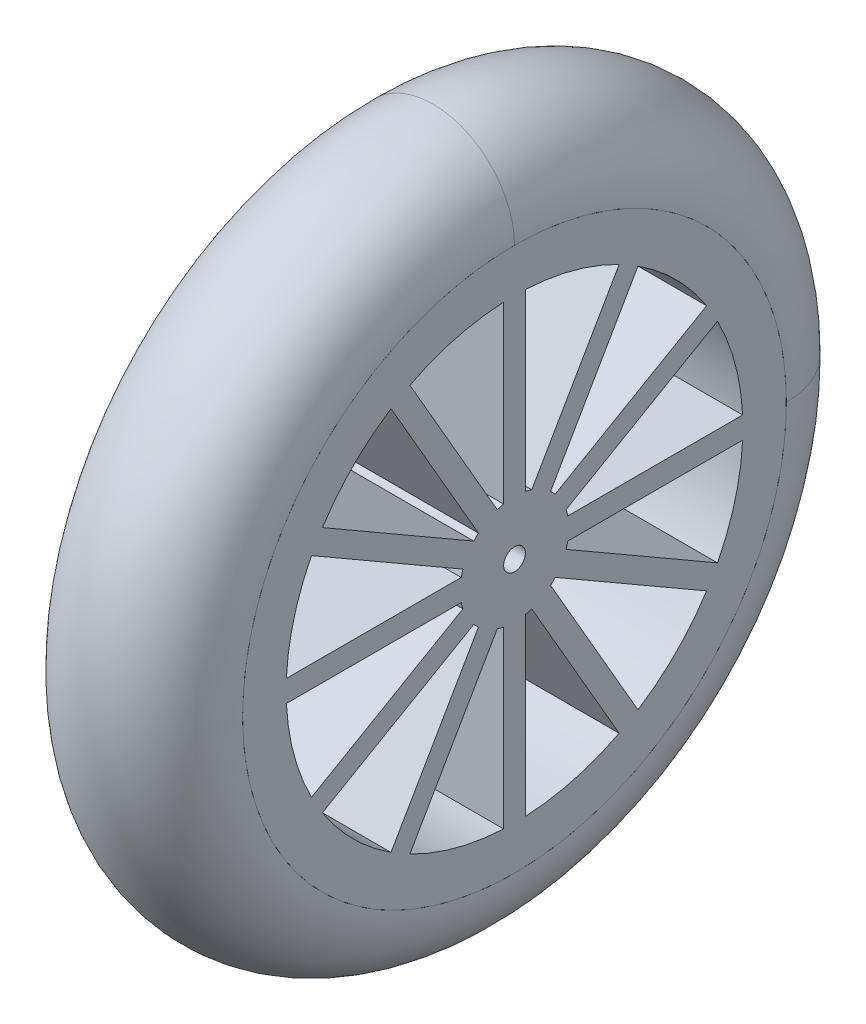
from build123d import *

# Parameters (mm, degrees)
SKETCH1_R               = 31.75
SKETCH1_R_2             = 1.27
BOSS_EXTRUDE1_DEPTH     = 19.05
CUT_EXTRUDE1_DEPTH      = 49.77527549896566
CUT_EXTRUDE1_DEPTH_BACK = 49.77527549896566


with BuildPart() as part:
    # Sketch1 → Boss-Extrude1 (new body)
    with BuildSketch(Plane(origin=(0, 0, 0), x_dir=(0, 0, -1), z_dir=(1, 0, 0))):
        with Locations(Location((0, 0, 0), (0, 0, 180))):
            Circle(SKETCH1_R)
        with Locations(Location((0, 0, 0), (0, 0, 180))):
            Circle(SKETCH1_R_2, mode=Mode.SUBTRACT)
    extrude(amount=BOSS_EXTRUDE1_DEPTH)

    # Sketch2 → Cut-Extrude1 (cut, two sides: drawn at the far end of the back side and taken through both)
    with BuildSketch(Plane(origin=(19.05, 0, 0), x_dir=(0, 0, -1), z_dir=(1, 0, 0)).offset(-CUT_EXTRUDE1_DEPTH_BACK)):
        with BuildLine():
            Line((-1.270000000000003, 6.221703946669272), (-1.27, 26.63974474352185))
            ThreePointArc((-1.27, 26.63974474352185), (-6.902703932884231, 25.76124178712945), (-12.2200201089547, 23.70569569822288))
            Line((-12.2200201089547, 23.70569569822288), (-2.0109997105283997, 6.023153672641492))
            ThreePointArc((-2.0109997105283997, 6.023153672641492), (-1.6435009364010087, 6.133628996935583), (-1.270000000000003, 6.221703946669272))
        make_face()
        with BuildLine():
            Line((1.27, 26.63974474352185), (1.270000000000003, 6.221703946669272))
            ThreePointArc((1.270000000000003, 6.221703946669272), (1.643500936401007, 6.133628996935585), (2.010999710528396, 6.023153672641493))
            Line((2.010999710528396, 6.023153672641493), (12.220020108954685, 23.70569569822289))
            ThreePointArc((12.220020108954685, 23.70569569822289), (6.902703932884228, 25.761241787129453), (1.27, 26.63974474352185))
        make_face()
        with BuildLine():
            Line((14.41972463456716, 22.435695698222887), (4.2107042361408755, 4.753153672641491))
            ThreePointArc((4.2107042361408755, 4.753153672641491), (4.490128060534575, 4.490128060534578), (4.753153672641489, 4.210704236140876))
            Line((4.753153672641489, 4.210704236140876), (22.435695698222883, 14.419724634567164))
            ThreePointArc((22.435695698222883, 14.419724634567164), (18.858537854245217, 18.858537854245224), (14.41972463456716, 22.435695698222887))
        make_face()
        with BuildLine():
            Line((23.705695698222886, 12.22002010895469), (6.023153672641493, 2.0109997105283974))
            ThreePointArc((6.023153672641493, 2.0109997105283974), (6.133628996935583, 1.6435009364010076), (6.221703946669272, 1.2700000000000038))
            Line((6.221703946669272, 1.2700000000000038), (26.63974474352185, 1.270000000000002))
            ThreePointArc((26.63974474352185, 1.270000000000002), (25.76124178712945, 6.902703932884231), (23.705695698222886, 12.22002010895469))
        make_face()
        with BuildLine():
            Line((26.63974474352185, -1.2699999999999985), (6.221703946669272, -1.270000000000002))
            ThreePointArc((6.221703946669272, -1.270000000000002), (6.133628996935585, -1.6435009364010065), (6.023153672641493, -2.010999710528396))
            Line((6.023153672641493, -2.010999710528396), (23.705695698222893, -12.220020108954682))
            ThreePointArc((23.705695698222893, -12.220020108954682), (25.761241787129453, -6.902703932884224), (26.63974474352185, -1.2699999999999985))
        make_face()
        with BuildLine():
            Line((22.43569569822289, -14.419724634567157), (4.753153672641491, -4.2107042361408755))
            ThreePointArc((4.753153672641491, -4.2107042361408755), (4.490128060534579, -4.490128060534576), (4.210704236140877, -4.753153672641489))
            Line((4.210704236140877, -4.753153672641489), (14.419724634567169, -22.43569569822288))
            ThreePointArc((14.419724634567169, -22.43569569822288), (18.858537854245224, -18.858537854245217), (22.43569569822289, -14.419724634567157))
        make_face()
        with BuildLine():
            Line((12.220020108954696, -23.705695698222883), (2.0109997105283988, -6.0231536726414925))
            ThreePointArc((2.0109997105283988, -6.0231536726414925), (1.6435009364010082, -6.133628996935584), (1.2700000000000038, -6.2217039466692725))
            Line((1.2700000000000038, -6.2217039466692725), (1.2700000000000036, -26.63974474352185))
            ThreePointArc((1.2700000000000036, -26.63974474352185), (6.902703932884234, -25.761241787129446), (12.220020108954696, -23.705695698222883))
        make_face()
        with BuildLine():
            Line((-1.2699999999999971, -26.63974474352185), (-1.270000000000002, -6.2217039466692725))
            ThreePointArc((-1.270000000000002, -6.2217039466692725), (-1.6435009364010047, -6.133628996935585), (-2.0109997105283943, -6.023153672641494))
            Line((-2.0109997105283943, -6.023153672641494), (-12.22002010895468, -23.705695698222893))
            ThreePointArc((-12.22002010895468, -23.705695698222893), (-6.9027039328842195, -25.761241787129457), (-1.2699999999999971, -26.63974474352185))
        make_face()
        with BuildLine():
            Line((-14.419724634567155, -22.43569569822289), (-4.210704236140875, -4.75315367264149))
            ThreePointArc((-4.210704236140875, -4.75315367264149), (-4.490128060534576, -4.490128060534577), (-4.753153672641489, -4.210704236140876))
            Line((-4.753153672641489, -4.210704236140876), (-22.43569569822288, -14.419724634567173))
            ThreePointArc((-22.43569569822288, -14.419724634567173), (-18.858537854245213, -18.858537854245235), (-14.419724634567155, -22.43569569822289))
        make_face()
        with BuildLine():
            Line((-23.705695698222883, -12.2200201089547), (-6.0231536726414925, -2.0109997105283997))
            ThreePointArc((-6.0231536726414925, -2.0109997105283997), (-6.133628996935583, -1.6435009364010085), (-6.221703946669272, -1.2700000000000038))
            Line((-6.221703946669272, -1.2700000000000038), (-26.63974474352185, -1.2700000000000056))
            ThreePointArc((-26.63974474352185, -1.2700000000000056), (-25.761241787129443, -6.902703932884247), (-23.705695698222883, -12.2200201089547))
        make_face()
        with BuildLine():
            Line((-26.63974474352185, 1.2699999999999951), (-6.221703946669272, 1.270000000000002))
            ThreePointArc((-6.221703946669272, 1.270000000000002), (-6.133628996935584, 1.6435009364010056), (-6.023153672641494, 2.0109997105283917))
            Line((-6.023153672641494, 2.0109997105283917), (-23.705695698222897, 12.22002010895467))
            ThreePointArc((-23.705695698222897, 12.22002010895467), (-25.761241787129453, 6.902703932884224), (-26.63974474352185, 1.2699999999999951))
        make_face()
        with BuildLine():
            Line((-22.435695698222894, 14.419724634567144), (-4.753153672641494, 4.210704236140872))
            ThreePointArc((-4.753153672641494, 4.210704236140872), (-4.49012806053458, 4.490128060534572), (-4.210704236140877, 4.7531536726414885))
            Line((-4.210704236140877, 4.7531536726414885), (-14.419724634567173, 22.435695698222876))
            ThreePointArc((-14.419724634567173, 22.435695698222876), (-18.858537854245238, 18.858537854245206), (-22.435695698222894, 14.419724634567144))
        make_face()
    extrude(amount=CUT_EXTRUDE1_DEPTH + CUT_EXTRUDE1_DEPTH_BACK, mode=Mode.SUBTRACT)


with BuildPart() as body_2:
    # Sweep1: sweep along a curve in space
    with BuildLine() as sweep1_path:
        ThreePointArc((19.05, 0, -31.75), (19.05, 22.45064030267288, -22.450640302672884), (19.05, 31.75, 0))
        ThreePointArc((19.05, 31.75, 0), (19.05, 22.450640302672884, 22.45064030267288), (19.05, 0, 31.75))
        ThreePointArc((19.05, 0, 31.75), (19.05, -22.45064030267288, 22.450640302672884), (19.05, -31.75, 0))
        ThreePointArc((19.05, -31.75, 0), (19.05, -22.450640302672884, -22.45064030267288), (19.05, 0, -31.75))
    # Sketch3 → Sweep1 (sweep)
    with BuildSketch(Plane.XY):
        with BuildLine():
            Line((19.05, 31.75), (1.388e-14, 31.75))
            ThreePointArc((1.388e-14, 31.75), (9.525000000000007, 41.27499999999999), (19.05, 31.75))
        make_face()
    sweep(path=sweep1_path.line)


solid = Compound([part.part, body_2.part])
